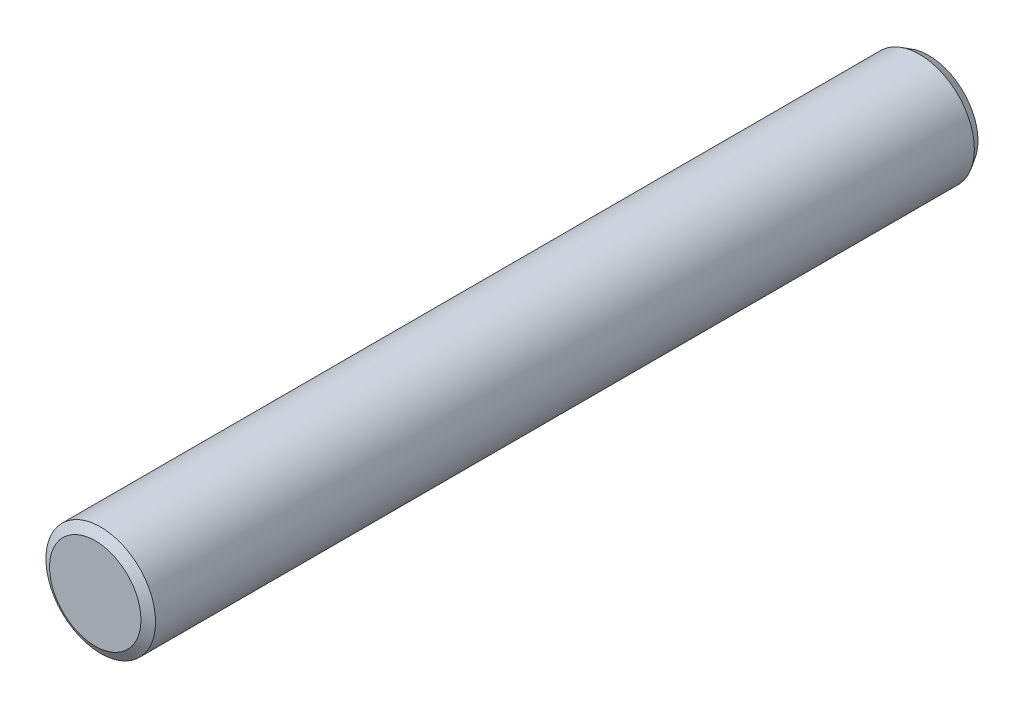
from build123d import *
from OCP.BRepFilletAPI import BRepFilletAPI_MakeChamfer

# Parameters (mm, degrees)
SKETCH1_R           = 5
BOSS_EXTRUDE1_DEPTH = 76
CHAMFER1_SIZE       = 0.5
CHAMFER1_SIZE2      = 0.832139741


with BuildPart() as part:
    # Sketch1 → Boss-Extrude1 (new body)
    with BuildSketch(Plane.XY):
        Circle(SKETCH1_R)
    extrude(amount=BOSS_EXTRUDE1_DEPTH)

    # Chamfer1: one chamfer whose edges measure the first distance from different faces: ONE call of the kernel's chamfer builder (chamfer() names one face for all edges)
    chamfer1_edges_1 = [part.edges().sort_by_distance(p)[0] for p in [
        (-5, 0, 0),
    ]]
    chamfer1_side_1 = [part.faces().sort_by_distance(p)[0] for p in [
        (0, 0, 0),
    ]]
    chamfer1_edges_2 = [part.edges().sort_by_distance(p)[0] for p in [
        (-5, 0, 76),
    ]]
    chamfer1_side_2 = [part.faces().sort_by_distance(p)[0] for p in [
        (-5, 0, 38),
    ]]
    chamfer1 = BRepFilletAPI_MakeChamfer(part.part.solid().wrapped)
    for e in chamfer1_edges_1:
        chamfer1.Add(CHAMFER1_SIZE, CHAMFER1_SIZE2, e.wrapped, chamfer1_side_1[0].wrapped)  # the first distance lies on this face
    for e in chamfer1_edges_2:
        chamfer1.Add(CHAMFER1_SIZE, CHAMFER1_SIZE2, e.wrapped, chamfer1_side_2[0].wrapped)  # the first distance lies on this face
    add(Compound.cast(chamfer1.Shape()), mode=Mode.REPLACE)


solid = part.part
